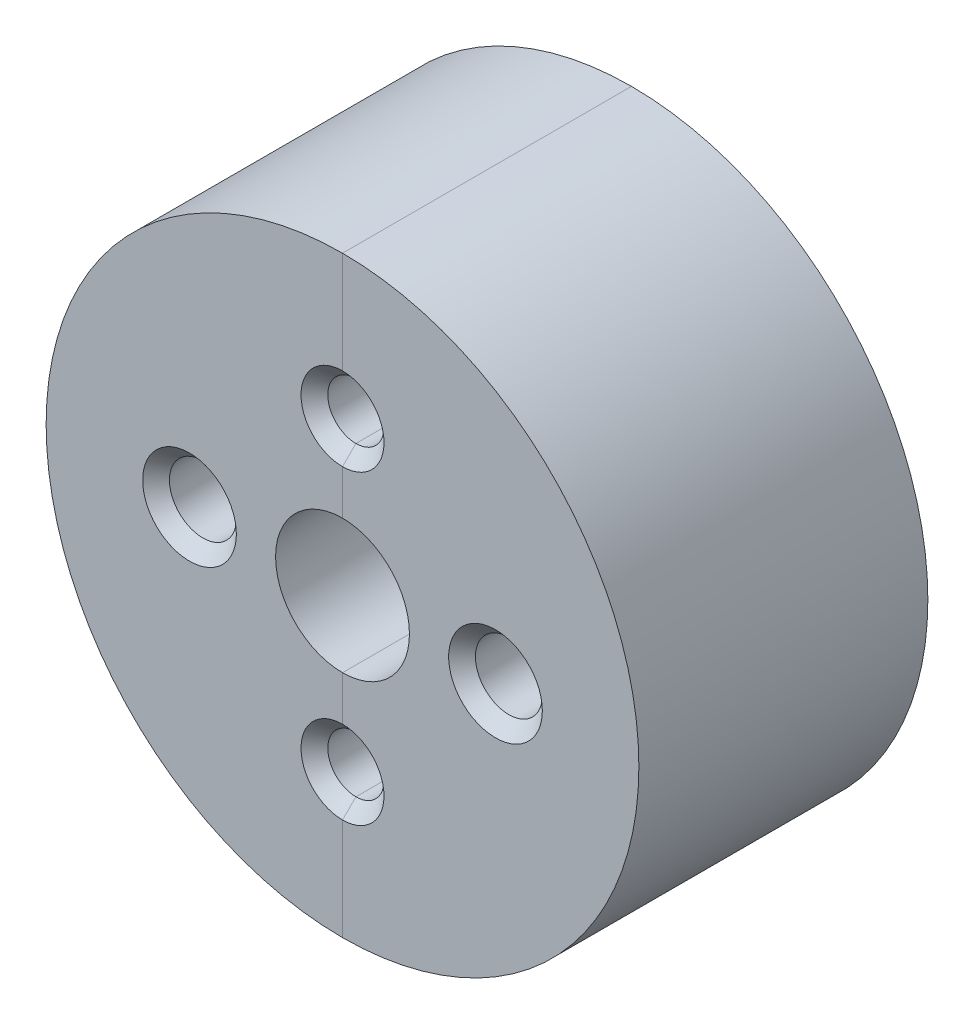
from build123d import *

# Parameters (mm, degrees)
SKETCH1_R                          = 22.14245
BOSS_EXTRUDE1_DEPTH                = 21.59
SKETCH4_R                          = 16.129
BOSS_EXTRUDE2_DEPTH                = 2
SKETCH6_R                          = 5
CUT_EXTRUDE1_DEPTH                 = 40.205411412
CHAMFER2_SIZE                      = 0.5
M5X0_8_TAPPED_HOLE1_D              = 4.2
CIRPATTERN1_COUNT                  = 2
F_5_0MM_TRANSITIONAL_DOWEL_HOLE1_D = 5
CIRPATTERN2_COUNT                  = 2
CHAMFER3_SIZE                      = 1
F_1_4_20_TAPPED_HOLE1_D            = 5.1054
F_1_4_20_TAPPED_HOLE1_DEPTH        = 19.05
F_1_4_20_TAPPED_HOLE1_TIP          = 1.533816902
SPLIT2_SURFACE_1_BACK              = 67.924
SPLIT2_SURFACE_1_DEPTH             = 135.848
SPLIT2_SURFACE_2_BACK              = 67.924
SPLIT2_SURFACE_2_DEPTH             = 135.848


with BuildPart() as part:
    # Sketch1 → Boss-Extrude1 (new body)
    with BuildSketch(Plane.XY):
        Circle(SKETCH1_R)
    extrude(amount=BOSS_EXTRUDE1_DEPTH)

    # Sketch4 → Boss-Extrude2 (add)
    with BuildSketch(Plane(origin=(0, 0, 0), x_dir=(-1, 0, 0), z_dir=(0, 0, -1))):
        Circle(SKETCH4_R)
    extrude(amount=BOSS_EXTRUDE2_DEPTH)

    # Sketch6 → Cut-Extrude1 (cut, through all)
    with BuildSketch(Plane.XY.offset(21.59)):
        Circle(SKETCH6_R)
    extrude(amount=-CUT_EXTRUDE1_DEPTH, mode=Mode.SUBTRACT)

    # Chamfer2
    chamfer2_edges = [part.edges().sort_by_distance(p)[0] for p in [
        (16.129, 0, -2),
    ]]
    chamfer(chamfer2_edges, length=CHAMFER2_SIZE)

    # M5x0.8 Tapped Hole1 (through all)
    with Locations(Plane(origin=(0, 11.43, -2), x_dir=(-1, 0, 0), z_dir=(0, 0, -1))):
        with Locations((0, 0)):
            m5x0_8_tapped_hole1 = Hole(M5X0_8_TAPPED_HOLE1_D / 2)

    # CirPattern1: M5x0.8 Tapped Hole1 ×2 about axis
    cirpattern1_axis = Axis((0, 0, 0), (0, 0, 1))
    for i in range(1, CIRPATTERN1_COUNT):
        add(m5x0_8_tapped_hole1.rotate(cirpattern1_axis, i * 360 / CIRPATTERN1_COUNT), mode=Mode.SUBTRACT)

    # Ø5.0mm Transitional Dowel Hole1 (through all)
    with Locations(Plane(origin=(-11.43, 0, -2), x_dir=(-1, 0, 0), z_dir=(0, 0, -1))):
        with Locations((0, 0)):
            f_5_0mm_transitional_dowel_hole1 = Hole(F_5_0MM_TRANSITIONAL_DOWEL_HOLE1_D / 2)

    # CirPattern2: Ø5.0mm Transitional Dowel Hole1 ×2 about axis
    cirpattern2_axis = Axis((0, 0, 0), (0, 0, 1))
    for i in range(1, CIRPATTERN2_COUNT):
        add(f_5_0mm_transitional_dowel_hole1.rotate(cirpattern2_axis, i * 360 / CIRPATTERN2_COUNT), mode=Mode.SUBTRACT)

    # Chamfer3
    chamfer3_edges = [part.edges().sort_by_distance(p)[0] for p in [
        (-2.1, 11.43, 21.59),
        (2.1, -11.43, 21.59),
        (-13.93, 0, 21.59),
        (13.93, 0, 21.59),
    ]]
    chamfer(chamfer3_edges, length=CHAMFER3_SIZE)

    # 1/4-20 Tapped Hole1
    with Locations(Plane(origin=(0.075011446, -22.142322942, 10.420095381), x_dir=(-0.999994261809, -0.003387675969, 0), z_dir=(0.003387675969, -0.999994261809, 0))):
        with Locations((0, 0)):
            Hole(F_1_4_20_TAPPED_HOLE1_D / 2, depth=F_1_4_20_TAPPED_HOLE1_DEPTH)
            with Locations((0, 0, -(F_1_4_20_TAPPED_HOLE1_DEPTH + F_1_4_20_TAPPED_HOLE1_TIP / 2))):  # 118° drill point
                Cone(0, F_1_4_20_TAPPED_HOLE1_D / 2, F_1_4_20_TAPPED_HOLE1_TIP, mode=Mode.SUBTRACT)


with BuildPart() as body_2:
    # Split2: the piece behind the surface
    add(part.part)
    # Split2 surface: a surface, the sketch's curves swept straight by 135.848 mm
    with BuildLine(Plane.XY.offset(21.59).offset(-SPLIT2_SURFACE_1_BACK), mode=Mode.PRIVATE) as split2_surface_1_path:
        Line((0, 22.14245), (0, -22.14245))
    split2_surface_1 = Shell.extrude(split2_surface_1_path.wire(), (0 * SPLIT2_SURFACE_1_DEPTH, 0 * SPLIT2_SURFACE_1_DEPTH, 1 * SPLIT2_SURFACE_1_DEPTH))
    split(bisect_by=split2_surface_1, keep=Keep.BOTTOM)


with BuildPart() as part_1:
    add(part.part)

    # Split2: split by a surface, the side it looks to stays
    # Split2 surface: a surface, the sketch's curves swept straight by 135.848 mm
    with BuildLine(Plane.XY.offset(21.59).offset(-SPLIT2_SURFACE_2_BACK), mode=Mode.PRIVATE) as split2_surface_2_path:
        Line((0, 22.14245), (0, -22.14245))
    split2_surface_2 = Shell.extrude(split2_surface_2_path.wire(), (0 * SPLIT2_SURFACE_2_DEPTH, 0 * SPLIT2_SURFACE_2_DEPTH, 1 * SPLIT2_SURFACE_2_DEPTH))
    split(bisect_by=split2_surface_2, keep=Keep.TOP)


solid = Compound([body_2.part, part_1.part])
